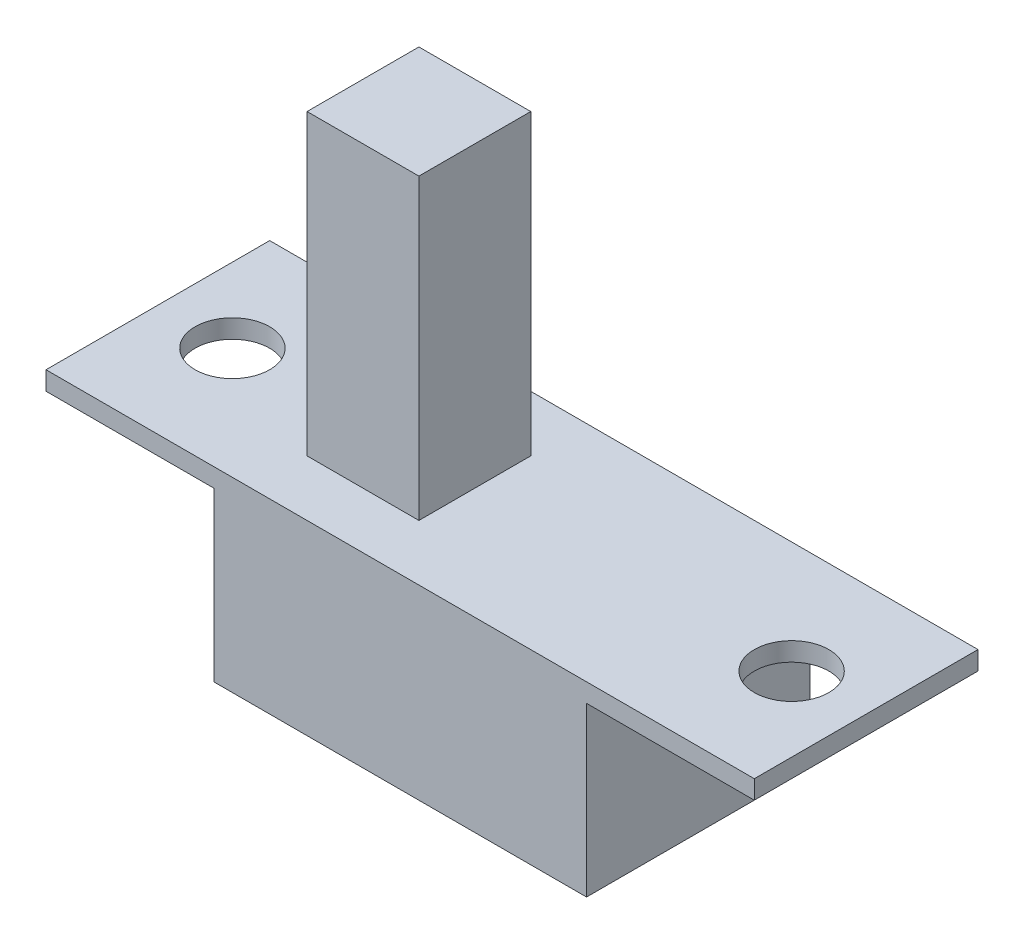
from build123d import *

# Parameters (mm, degrees)
SKETCH1_W           = 10
SKETCH1_H           = 6
BOSS_EXTRUDE1_DEPTH = 5
SKETCH2_W           = 19
SKETCH2_H           = 6
SKETCH2_R           = 1
BOSS_EXTRUDE2_DEPTH = 0.5
SKETCH3_W           = 3
SKETCH3_H           = 3
BOSS_EXTRUDE3_DEPTH = 8


with BuildPart() as part:
    # Sketch1 → Boss-Extrude1 (new body)
    with BuildSketch(Plane(origin=(0, 0, 0), x_dir=(1, 0, 0), z_dir=(0, 1, 0))):
        Rectangle(SKETCH1_W, SKETCH1_H)
    extrude(amount=BOSS_EXTRUDE1_DEPTH)

    # Sketch2 → Boss-Extrude2 (add)
    with BuildSketch(Plane(origin=(0, 5, 0), x_dir=(1, 0, 0), z_dir=(0, 1, 0))):
        Rectangle(SKETCH2_W, SKETCH2_H)
        with Locations(Location((-7.5, 0, 0), (0, 0, 270))):
            Circle(SKETCH2_R, mode=Mode.SUBTRACT)
        with Locations(Location((7.5, 0, 0), (0, 0, 270))):
            Circle(SKETCH2_R, mode=Mode.SUBTRACT)
    extrude(amount=-BOSS_EXTRUDE2_DEPTH)

    # Sketch3 → Boss-Extrude3 (add)
    with BuildSketch(Plane(origin=(0, 5, 0), x_dir=(1, 0, 0), z_dir=(0, 1, 0))):
        with Locations((-2.497009228, 0)):
            Rectangle(SKETCH3_W, SKETCH3_H)
    extrude(amount=BOSS_EXTRUDE3_DEPTH)


solid = part.part
